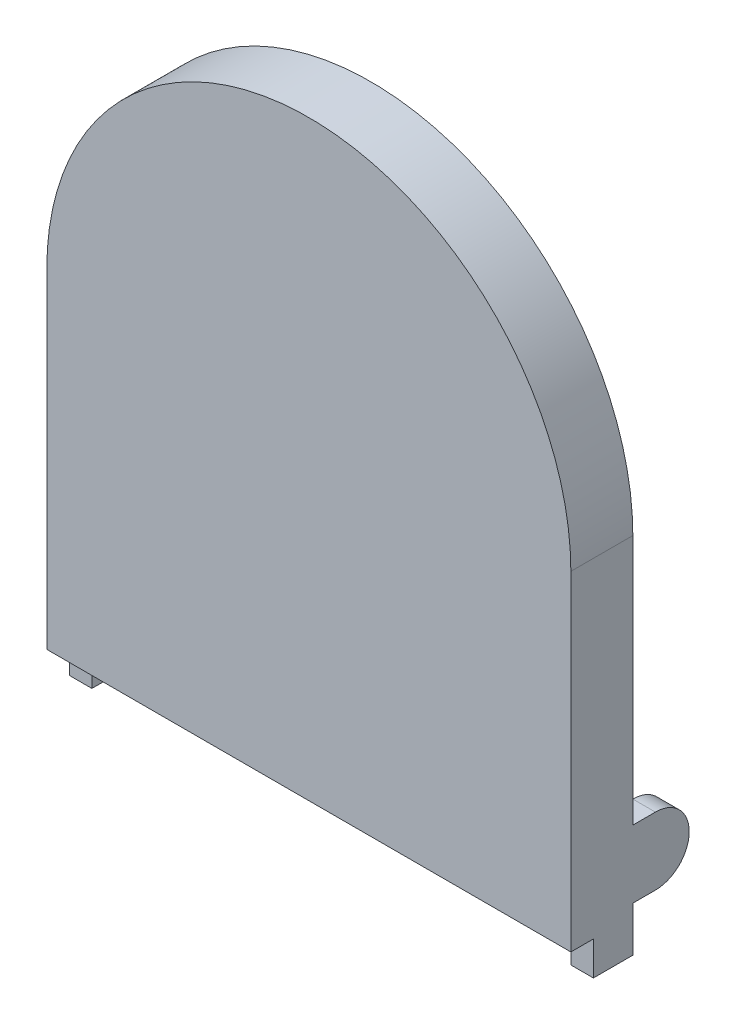
from build123d import *

# Parameters (mm, degrees)
BOSS_EXTRUDE1_DEPTH  = 3.5
BOSS_EXTRUDE2_DEPTH  = 2
BOSS_EXTRUDE3_DEPTH  = 2
SKETCH4_R            = 1.5
BOSS_EXTRUDE4_DEPTH  = 1.5
FILLET1_R            = 1
FILLET1_OF_MIRROR1_R = 1


with BuildPart() as part:
    # Sketch1 → Boss-Extrude1 (new body)
    with BuildSketch(Plane.XY):
        with BuildLine():
            Line((42.5, 0), (42.5, 32.25))
            ThreePointArc((42.5, 32.25), (21.25, 53.5), (0, 32.25))
            Line((0, 32.25), (0, 0))
            Line((0, 0), (-2, 0))
            Line((-2, 0), (-2, 32.25))
            ThreePointArc((-2, 32.25), (21.25, 55.5), (44.5, 32.25))
            Line((44.5, 32.25), (44.5, 0))
            Line((44.5, 0), (42.5, 0))
        make_face()
    boss_extrude1 = extrude(amount=BOSS_EXTRUDE1_DEPTH)

    # Sketch2 → Boss-Extrude2 (add)
    with BuildSketch(Plane.XY.offset(3.5)):
        with BuildLine():
            Line((-2, 3), (44.5, 3))
            Line((44.5, 3), (44.5, 32.25))
            ThreePointArc((44.5, 32.25), (21.25, 55.5), (-2, 32.25))
            Line((-2, 32.25), (-2, 3))
        make_face()
    extrude(amount=BOSS_EXTRUDE2_DEPTH)

    # Sketch3 → Boss-Extrude3 (add)
    with BuildSketch(Plane.ZY.offset(2)):
        with BuildLine():
            Line((0, 4), (-2, 4))
            ThreePointArc((-2, 4), (-5, 7), (-2, 10))
            Line((-2, 10), (0, 10))
            Line((0, 10), (0, 4))
        make_face()
    boss_extrude3 = extrude(amount=-BOSS_EXTRUDE3_DEPTH)

    # Sketch4 → Boss-Extrude4 (add)
    with BuildSketch(Plane(origin=(0, 0, 0), x_dir=(0, 0, -1), z_dir=(1, 0, 0))):
        with Locations(Location((2, 7, 0), (0, 0, 180))):
            Circle(SKETCH4_R)
    boss_extrude4 = extrude(amount=BOSS_EXTRUDE4_DEPTH)

    # Fillet1
    fillet1_edges = [part.edges().sort_by_distance(p)[0] for p in [
        (1.5, 7, -3.5),
    ]]
    fillet(fillet1_edges, radius=FILLET1_R)

    # Mirror1: Boss-Extrude1, Boss-Extrude3, Boss-Extrude4 across plane
    add(boss_extrude1.mirror(Plane(origin=(21.25, 0, 0), x_dir=(0, 0, 1), z_dir=(1, 0, 0))))
    add(boss_extrude3.mirror(Plane(origin=(21.25, 0, 0), x_dir=(0, 0, 1), z_dir=(1, 0, 0))))
    add(boss_extrude4.mirror(Plane(origin=(21.25, 0, 0), x_dir=(0, 0, 1), z_dir=(1, 0, 0))))

    # Fillet1 of Mirror1
    fillet1_of_mirror1_edges = [part.edges().sort_by_distance(p)[0] for p in [
        (41, 7, -3.5),
    ]]
    fillet(fillet1_of_mirror1_edges, radius=FILLET1_OF_MIRROR1_R)


solid = part.part
